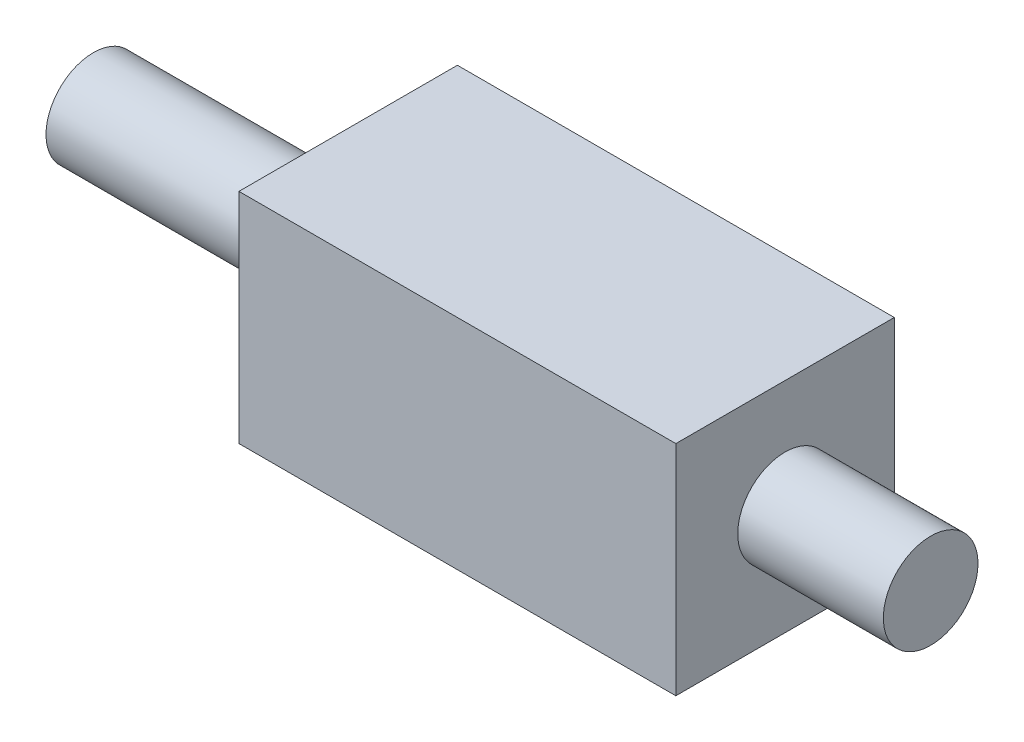
from build123d import *

# Parameters (mm, degrees)
CROQUIS1_W              = 3
CROQUIS1_H              = 3
SALIENTE_EXTRUIR1_DEPTH = 6
CROQUIS2_R              = 0.65
SALIENTE_EXTRUIR2_DEPTH = 3.5
SALIENTE_EXTRUIR3_START = 2
CROQUIS6_R              = 0.65
SALIENTE_EXTRUIR3_DEPTH = 2


with BuildPart() as part:
    # Croquis1 → Saliente-Extruir1 (new body)
    with BuildSketch(Plane(origin=(0, 0, 0), x_dir=(0, 0, -1), z_dir=(1, 0, 0))):
        with Locations((0, 0.5)):
            Rectangle(CROQUIS1_W, CROQUIS1_H)
    extrude(amount=SALIENTE_EXTRUIR1_DEPTH)

    # Croquis2 → Saliente-Extruir2 (add)
    with BuildSketch(Plane.ZY):
        with Locations(Location((0, 0.5, 0), (0, 0, 180))):
            Circle(CROQUIS2_R)
    extrude(amount=SALIENTE_EXTRUIR2_DEPTH)

    # Croquis6 → Saliente-Extruir3 (add)
    with BuildSketch(Plane(origin=(6, 0, 0), x_dir=(0, 0, -1), z_dir=(1, 0, 0)).offset(SALIENTE_EXTRUIR3_START)):
        with Locations((0, 0.5)):
            Circle(CROQUIS6_R)
    extrude(amount=-SALIENTE_EXTRUIR3_DEPTH)


solid = part.part
